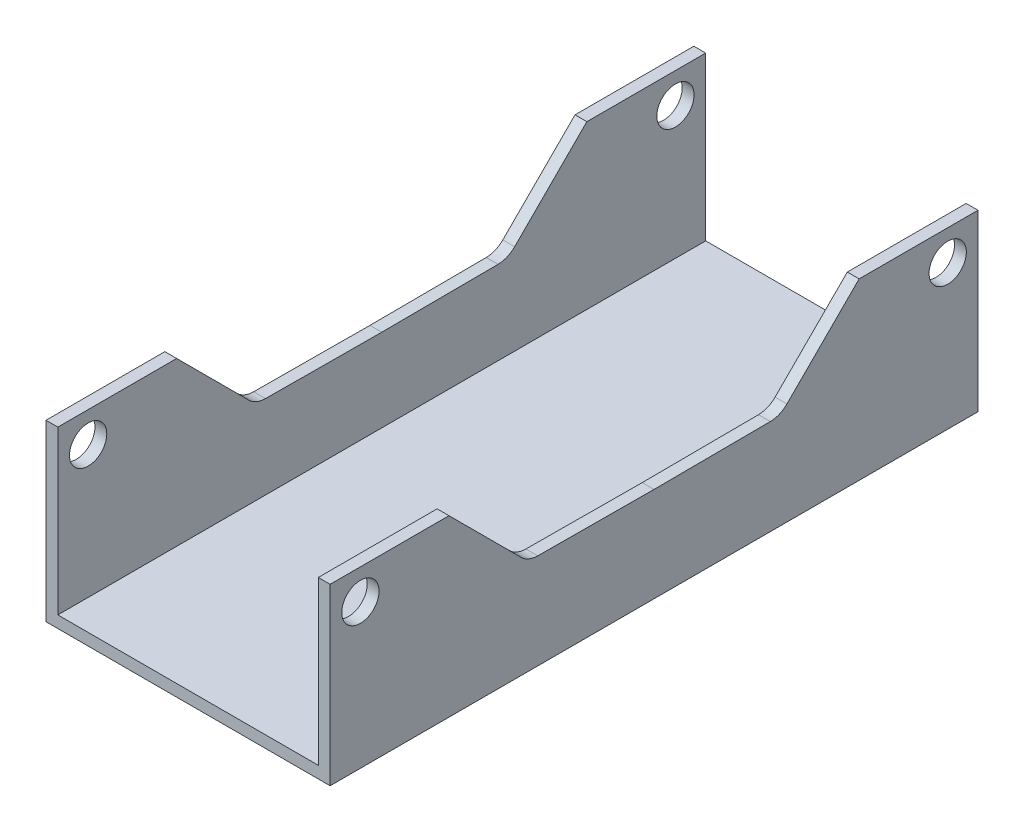
from build123d import *

# Parameters (mm, degrees)
SKETCH1_W               = 76.2
SKETCH1_H               = 50.8
SKETCH1_W_2             = 69.85
SKETCH1_H_2             = 44.45
BOSS_EXTRUDE1_DEPTH     = 173.75
CUT_EXTRUDE1_DEPTH      = 180.682588194
CUT_EXTRUDE1_DEPTH_BACK = 180.682588194
SKETCH2_R               = 5
FILLET1_R               = 6.35


with BuildPart() as part:
    # Sketch1 → Boss-Extrude1 (new body)
    with BuildSketch(Plane.XY):
        Rectangle(SKETCH1_W, SKETCH1_H)
        Rectangle(SKETCH1_W_2, SKETCH1_H_2, mode=Mode.SUBTRACT)
    extrude(amount=BOSS_EXTRUDE1_DEPTH)

    # Sketch2 → Cut-Extrude1 (cut, two sides: drawn at the far end of the back side and taken through both)
    with BuildSketch(Plane(origin=(0, 0, 0), x_dir=(0, 0, -1), z_dir=(1, 0, 0)).offset(-CUT_EXTRUDE1_DEPTH_BACK)):
        with Locations((-165.625, 13.275)):
            Circle(SKETCH2_R)
        with Locations((-8.125, 13.275)):
            Circle(SKETCH2_R)
        Polygon((-173.75, 25.4), (0, 25.4), (0, 21.4), (-31.875, 21.4), (-53.088203436, 0.186796564), (-86.875, 0), (-120.661796564, 0.186796564), (-141.875, 21.4), (-173.75, 21.4), align=None)
    extrude(amount=CUT_EXTRUDE1_DEPTH + CUT_EXTRUDE1_DEPTH_BACK, mode=Mode.SUBTRACT)

    # Fillet1
    fillet1_edges = [part.edges().sort_by_distance(p)[0] for p in [
        (-36.5125, 0.186796564, 53.088203436),
        (-36.5125, 0.186796564, 120.661796564),
        (36.5125, 0.186796564, 53.088203436),
        (36.5125, 0.186796564, 120.661796564),
    ]]
    fillet(fillet1_edges, radius=FILLET1_R)


solid = part.part
